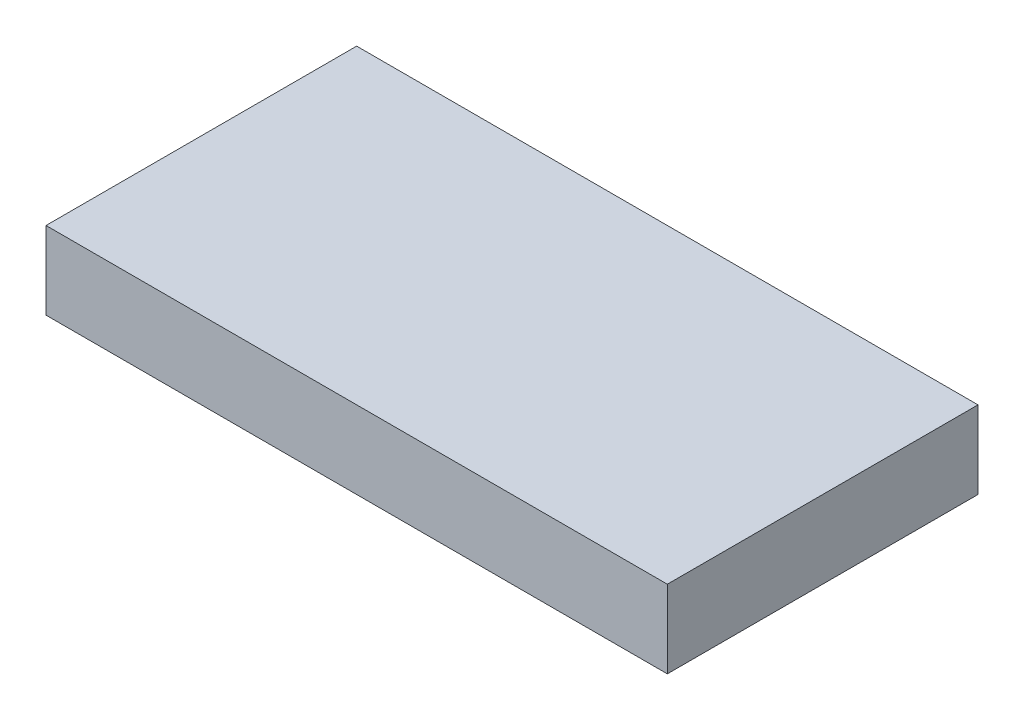
from build123d import *

# Parameters (mm, degrees)
SKETCH1_W           = 40
SKETCH1_H           = 20
BOSS_EXTRUDE1_DEPTH = 5


with BuildPart() as part:
    # Sketch1 → Boss-Extrude1 (new body)
    with BuildSketch(Plane(origin=(0, 0, 0), x_dir=(1, 0, 0), z_dir=(0, 1, 0))):
        with Locations((-9.254658385, -2.670807453)):
            Rectangle(SKETCH1_W, SKETCH1_H)
    extrude(amount=BOSS_EXTRUDE1_DEPTH)


solid = part.part
